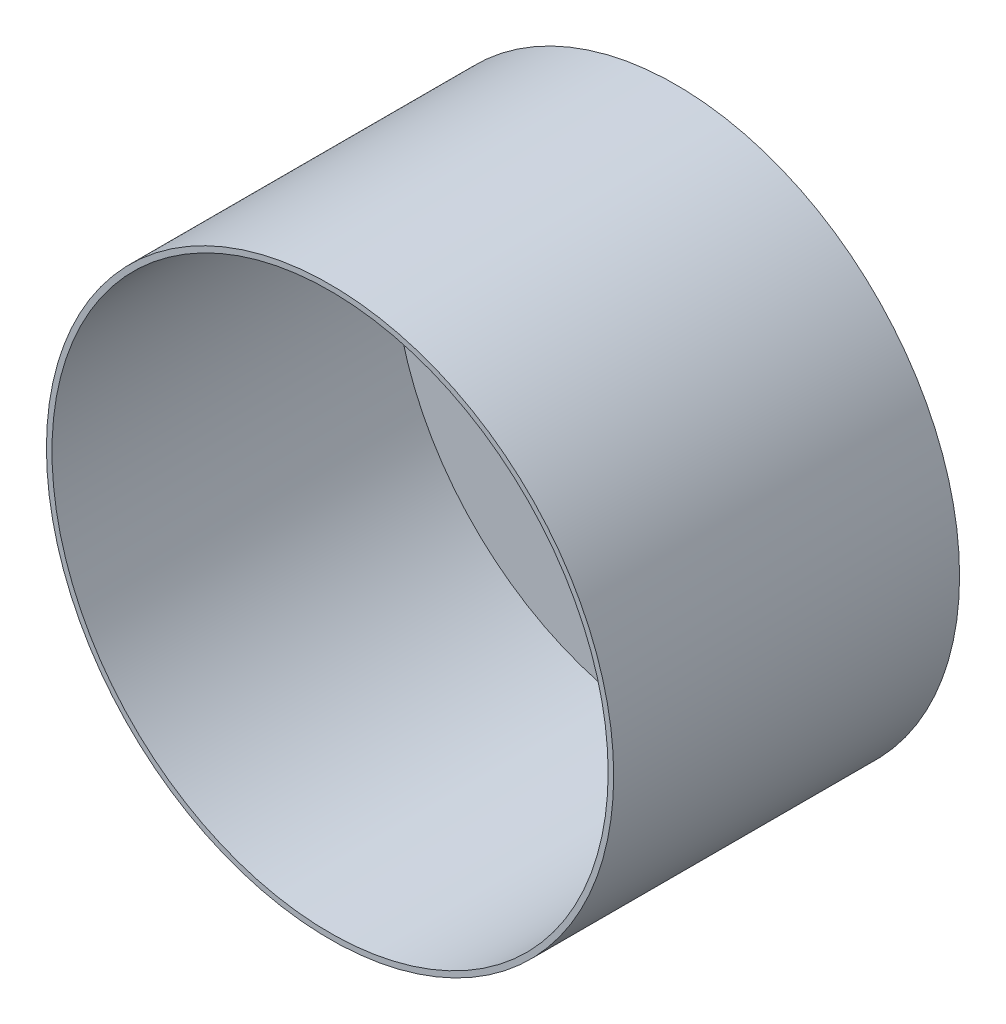
from build123d import *

# Parameters (mm, degrees)
SKETCH1_R           = 100.5
SKETCH1_R_2         = 50.5
BOSS_EXTRUDE1_DEPTH = 1.5
SKETCH1_3_R         = 102.5
SKETCH1_3_R_2       = 100.5
BOSS_EXTRUDE2_DEPTH = 125


with BuildPart() as part:
    # Sketch1 → Boss-Extrude1 (new body)
    with BuildSketch(Plane.XY):
        Circle(SKETCH1_R)
        Circle(SKETCH1_R_2, mode=Mode.SUBTRACT)
    extrude(amount=BOSS_EXTRUDE1_DEPTH)

    # Sketch1<3> → Boss-Extrude2 (add)
    with BuildSketch(Plane.XY):
        Circle(SKETCH1_3_R)
        Circle(SKETCH1_3_R_2, mode=Mode.SUBTRACT)
    extrude(amount=BOSS_EXTRUDE2_DEPTH)


solid = part.part
